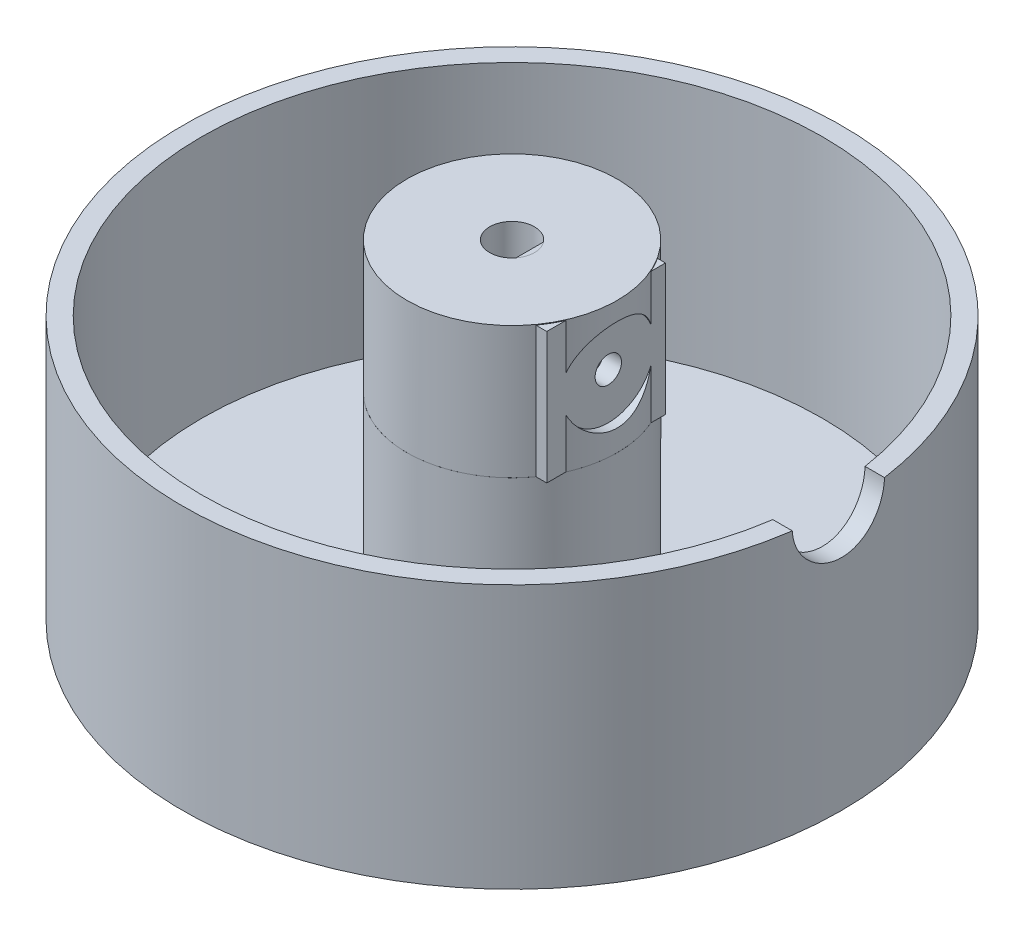
from build123d import *

# Parameters (mm, degrees)
SKETCH1_R               = 15.958
BOSS_EXTRUDE1_DEPTH     = 20
SKETCH2_R               = 3.4
CUT_EXTRUDE1_DEPTH      = 13.55
SKETCH5_W               = 1.550685087
SKETCH5_H               = 7.184215806
BOSS_EXTRUDE2_DEPTH     = 13.55
SKETCH7_W               = 18.003976239
SKETCH7_H               = 19.909960041
BOSS_EXTRUDE3_DEPTH     = 12
CUT_EXTRUDE2_DEPTH      = 1
CUT_EXTRUDE2_DEPTH_BACK = 13.55
SKETCH6_R               = 2
NUTOPENING_DEPTH        = 30
SKETCH10_R              = 50
BOSS_EXTRUDE4_DEPTH     = 30
SKETCH12_R              = 47.082764373
SKETCH12_R_2            = 15.95790089
CUT_EXTRUDE5_DEPTH      = 27
BOSS_EXTRUDE5_START     = 10
SKETCH13_R              = 50
SKETCH13_R_2            = 47.082764373
BOSS_EXTRUDE5_DEPTH     = 10
CUT_EXTRUDE6_DEPTH      = 6.93308615
SKETCH16_R              = 7
CUT_EXTRUDE7_DEPTH      = 40


with BuildPart() as part:
    # Sketch1 → Boss-Extrude1 (new body)
    with BuildSketch(Plane(origin=(0, 0, 0), x_dir=(1, 0, 0), z_dir=(0, 1, 0))):
        with Locations(Location((0, 0, 0), (0, 0, 270))):
            Circle(SKETCH1_R)
    extrude(amount=BOSS_EXTRUDE1_DEPTH)

    # Sketch2 → Cut-Extrude1 (cut)
    with BuildSketch(Plane(origin=(0, 20, 0), x_dir=(1, 0, 0), z_dir=(0, 1, 0))):
        with Locations(Location((0, 0, 0), (0, 0, 270))):
            Circle(SKETCH2_R)
    extrude(amount=-CUT_EXTRUDE1_DEPTH, mode=Mode.SUBTRACT)

    # Sketch5 → Boss-Extrude2 (add)
    with BuildSketch(Plane(origin=(0, 18.26, 0), x_dir=(1, 0, 0), z_dir=(0, 1, 0))):
        with Locations((3.375342544, 0.020519704)):
            Rectangle(SKETCH5_W, SKETCH5_H)
    extrude(amount=-BOSS_EXTRUDE2_DEPTH)

    # Sketch7 → Boss-Extrude3 (add)
    with BuildSketch(Plane.ZY.offset(-2.6)):
        with Locations((0.33027221, 9.954980021)):
            Rectangle(SKETCH7_W, SKETCH7_H)
    extrude(amount=-BOSS_EXTRUDE3_DEPTH)

    # Sketch6 → Cut-Extrude2 (cut, two sides: drawn at the far end of the back side and taken through both)
    with BuildSketch(Plane.ZY.offset(-2.6).offset(-CUT_EXTRUDE2_DEPTH_BACK)):
        with Locations(Location((0, 10.236925537, 0), (0, 0, 180))):
            Circle(SKETCH6_R)
    extrude(amount=CUT_EXTRUDE2_DEPTH + CUT_EXTRUDE2_DEPTH_BACK, mode=Mode.SUBTRACT)

    # Sketch9 → NutOpening (cut)
    with BuildSketch(Plane.XY):
        Polygon((11.876516377, 10.236925537), (11.876516377, 5.861925537), (4.943430227, 5.861925537), (4.943430227, 10.236925537), (4.943430227, 14.614332445), (11.876516377, 14.614332445), align=None)
    extrude(amount=-NUTOPENING_DEPTH, mode=Mode.SUBTRACT)

    # Sketch10 → Boss-Extrude4 (add)
    with BuildSketch(Plane.XZ):
        with Locations(Location((0, 0, 0), (0, 0, 270))):
            Circle(SKETCH10_R)
    extrude(amount=BOSS_EXTRUDE4_DEPTH)

    # Sketch12 → Cut-Extrude5 (cut)
    with BuildSketch(Plane(origin=(0, 0, 0), x_dir=(1, 0, 0), z_dir=(0, 1, 0))):
        with Locations(Location((0, 0, 0), (0, 0, 270))):
            Circle(SKETCH12_R)
        with Locations(Location((0, 0, 0), (0, 0, 270))):
            Circle(SKETCH12_R_2, mode=Mode.SUBTRACT)
    extrude(amount=-CUT_EXTRUDE5_DEPTH, mode=Mode.SUBTRACT)

    # Sketch13 → Boss-Extrude5 (add)
    with BuildSketch(Plane(origin=(0, 0, 0), x_dir=(1, 0, 0), z_dir=(0, 1, 0)).offset(BOSS_EXTRUDE5_START)):
        with Locations(Location((0, 0, 0), (0, 0, 270))):
            Circle(SKETCH13_R)
        with Locations(Location((0, 0, 0), (0, 0, 270))):
            Circle(SKETCH13_R_2, mode=Mode.SUBTRACT)
    extrude(amount=-BOSS_EXTRUDE5_DEPTH)

    # Sketch14 → Cut-Extrude6 (cut)
    with BuildSketch(Plane.ZY.offset(-11.876516377)):
        Polygon((-5.054124256, 10.236925537), (-2.527062128, 5.859925537), (2.527062128, 5.859925537), (5.054124256, 10.236925537), (2.527062128, 14.613925537), (-2.527062128, 14.613925537), align=None)
    extrude(amount=CUT_EXTRUDE6_DEPTH, mode=Mode.SUBTRACT)

    # Sketch16 → Cut-Extrude7 (cut)
    with BuildSketch(Plane(origin=(14.6, 0, 0), x_dir=(0, 0, -1), z_dir=(1, 0, 0))):
        with Locations((0, 10.236925537)):
            Circle(SKETCH16_R)
    extrude(amount=CUT_EXTRUDE7_DEPTH, mode=Mode.SUBTRACT)


solid = part.part
